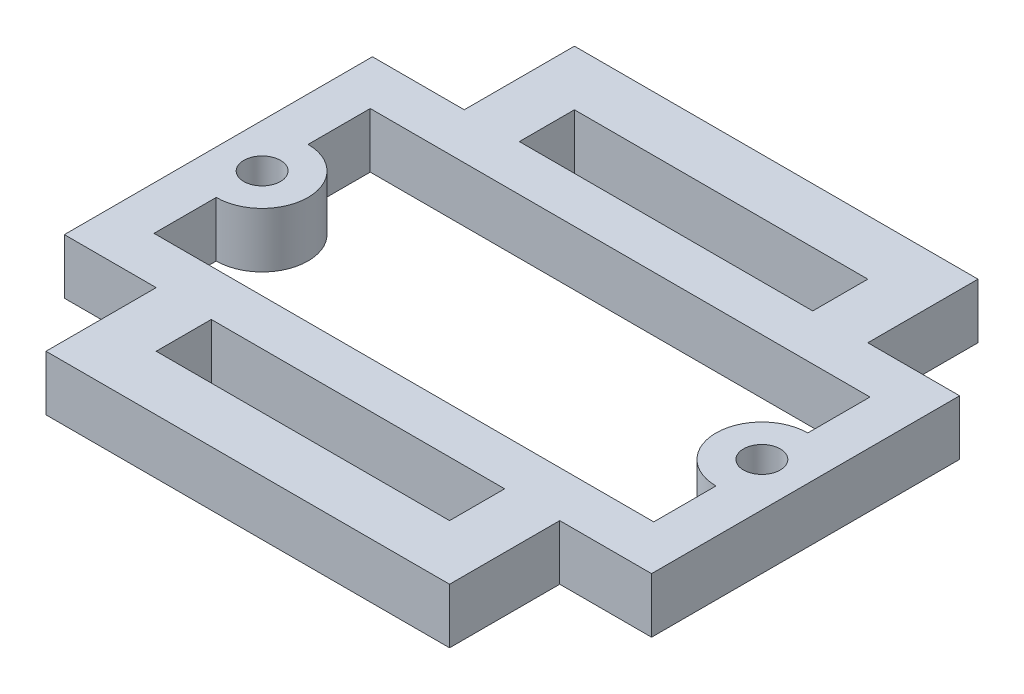
from build123d import *

# Parameters (mm, degrees)
SKETCH1_W           = 16.2306
SKETCH1_H           = 3.048
SKETCH1_R           = 1.016
BOSS_EXTRUDE1_DEPTH = 3.048


with BuildPart() as part:
    # Sketch1 → Boss-Extrude1 (new body)
    with BuildSketch(Plane(origin=(0, 0, 0), x_dir=(1, 0, 0), z_dir=(0, 1, 0))):
        Polygon((0, 8.5217), (0, -8.5217), (5.08, -8.5217), (5.08, -14.6177), (27.4066, -14.6177), (27.4066, -8.5217), (32.4866, -8.5217), (32.4866, 8.5217), (27.4066, 8.5217), (27.4066, 14.6177), (5.08, 14.6177), (5.08, 8.5217), align=None)
        with Locations((16.2433, -10.0457)):
            Rectangle(SKETCH1_W, SKETCH1_H, mode=Mode.SUBTRACT)
        with Locations((16.2433, 10.0457)):
            Rectangle(SKETCH1_W, SKETCH1_H, mode=Mode.SUBTRACT)
        with BuildLine():
            Line((30.06725, -5.9817), (2.41935, -5.9817))
            Line((2.41935, -5.9817), (2.41935, -2.54))
            ThreePointArc((2.41935, -2.54), (4.95935, 0), (2.41935, 2.54))
            Line((2.41935, 2.54), (2.41935, 5.9817))
            Line((2.41935, 5.9817), (30.06725, 5.9817))
            Line((30.06725, 5.9817), (30.06725, 2.54))
            ThreePointArc((30.06725, 2.54), (27.52725, 0), (30.06725, -2.54))
            Line((30.06725, -2.54), (30.06725, -5.9817))
        make_face(mode=Mode.SUBTRACT)
        with Locations(Location((2.41935, 0, 0), (0, 0, 90))):
            Circle(SKETCH1_R, mode=Mode.SUBTRACT)
        with Locations(Location((30.06725, 0, 0), (0, 0, 90))):
            Circle(SKETCH1_R, mode=Mode.SUBTRACT)
    extrude(amount=BOSS_EXTRUDE1_DEPTH)


solid = part.part
